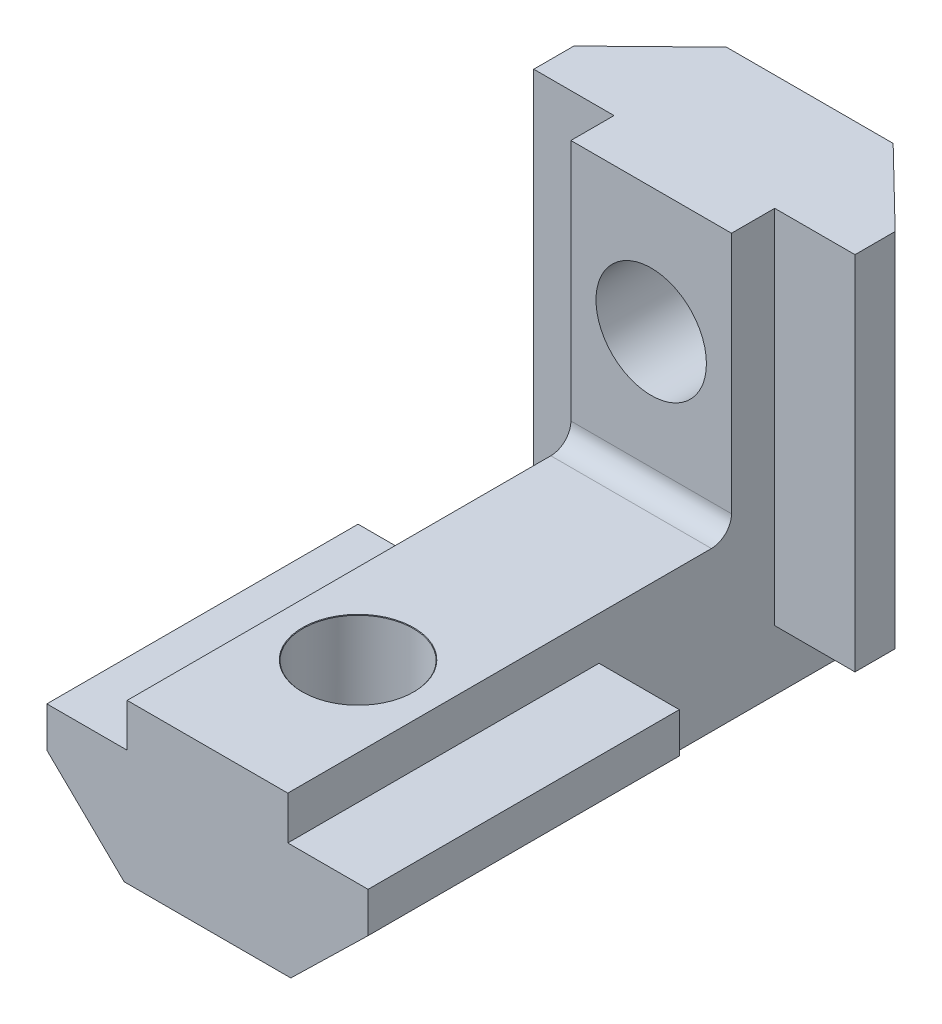
from build123d import *

# Parameters (mm, degrees)
ESTRUSIONE_ESTRUSIONE1_DEPTH   = 15.5
SCHIZZO2_W                     = 8
SCHIZZO2_H                     = 7.9
ESTRUSIONE_ESTRUSIONE2_DEPTH   = 14.5
ESTRUSIONE_ESTRUSIONE3_DEPTH   = 18
RACCORDO1_R                    = 1
FORO_PER_VITE_M5_1_D           = 5.5
FORO_PER_VITE_M5_1_CSINK_D     = 5.55
FORO_PER_VITE_M5_1_CSINK_ANGLE = 90
FORO_PER_VITE_M5_2_D           = 5.5


with BuildPart() as part:
    # Schizzo1 → Estrusione-Estrusione1 (new body)
    with BuildSketch(Plane.XY):
        Polygon((-4.15, 0), (4.15, 0), (8, 3.75), (8, 5.75), (4, 5.75), (4, 7.9), (-4, 7.9), (-4, 5.75), (-8, 5.75), (-8, 3.75), align=None)
    extrude(amount=-ESTRUSIONE_ESTRUSIONE1_DEPTH)

    # Schizzo2 → Estrusione-Estrusione2 (add)
    with BuildSketch(Plane(origin=(0, 0, -15.5), x_dir=(-1, 0, 0), z_dir=(0, 0, -1))):
        with Locations((0, 3.95)):
            Rectangle(SCHIZZO2_W, SCHIZZO2_H)
    extrude(amount=ESTRUSIONE_ESTRUSIONE2_DEPTH)

    # Schizzo4 → Estrusione-Estrusione3 (add)
    with BuildSketch(Plane(origin=(0, 21, 0), x_dir=(-1, 0, 0), z_dir=(0, -1, 0))):
        Polygon((-4.15, 30), (4.15, 30), (8, 26.25), (8, 24.25), (4, 24.25), (4, 22.1), (-4, 22.1), (-4, 24.25), (-8, 24.25), (-8, 26.25), align=None)
    extrude(amount=ESTRUSIONE_ESTRUSIONE3_DEPTH)

    # Raccordo1
    raccordo1_edges = [part.edges().sort_by_distance(p)[0] for p in [
        (0, 7.9, -22.1),
    ]]
    fillet(raccordo1_edges, radius=RACCORDO1_R)

    # Foro per Vite M5-1 (through all)
    with Locations(Plane(origin=(0, 7.9, 0), x_dir=(1, 0, 0), z_dir=(0, 1, 0))):
        with Locations((0, 7.5)):
            CounterSinkHole(FORO_PER_VITE_M5_1_D / 2, FORO_PER_VITE_M5_1_CSINK_D / 2, counter_sink_angle=FORO_PER_VITE_M5_1_CSINK_ANGLE)

    # Foro per Vite M5-2 (through all)
    with Locations(Plane.XY.offset(-22.1)):
        with Locations((0, 14.75)):
            Hole(FORO_PER_VITE_M5_2_D / 2)


solid = part.part
